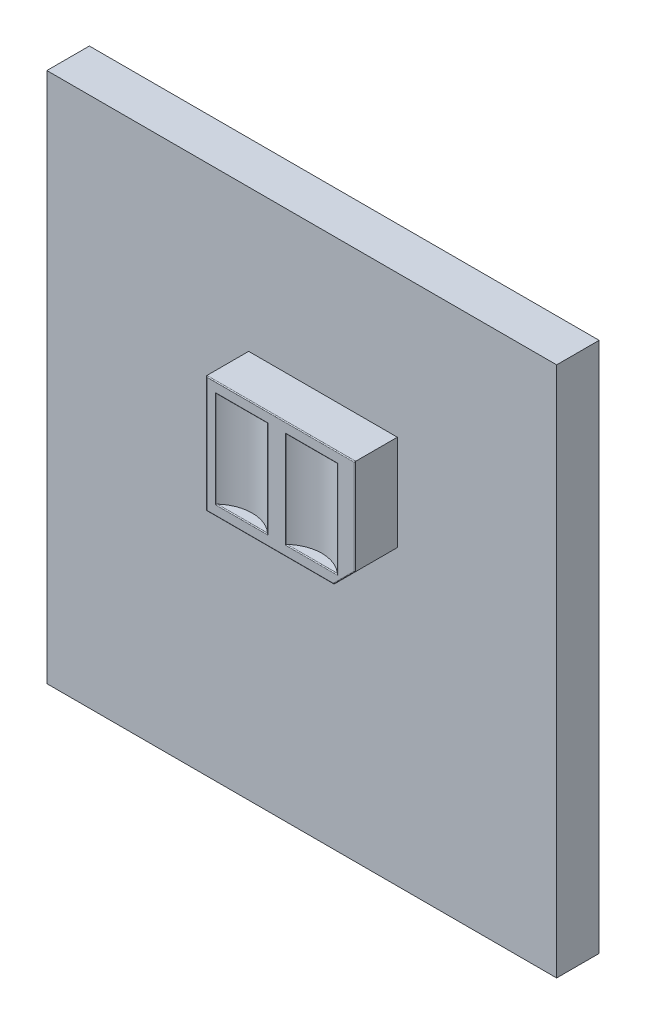
from build123d import *

# Parameters (mm, degrees)
ESQUISSE1_W             = 12
ESQUISSE1_H             = 12.5
EXTRUSION1_DEPTH        = 1
EXTRUSION2_DEPTH        = 2
ENL_V_MAT_EXTRU_1_DEPTH = 2.25
CONG_1_R                = 0.02


with BuildPart() as part:
    # Esquisse1 → Extrusion1 (new body)
    with BuildSketch(Plane.XY):
        Rectangle(ESQUISSE1_W, ESQUISSE1_H)
    extrude(amount=EXTRUSION1_DEPTH)

    # Esquisse3 → Extrusion2 (add)
    with BuildSketch(Plane.XY):
        Polygon((-1.25, 2.9), (2.25, 2.9), (2.25, 0.65), (1.75, 0.15), (-1.25, 0.15), align=None)
    extrude(amount=EXTRUSION2_DEPTH)

    # Esquisse4 → Enlèv. mat.-Extru.1 (cut)
    with BuildSketch(Plane.XZ.offset(-0.4)):
        with BuildLine():
            Line((0.619431951, 2), (1.839642881, 2))
            ThreePointArc((1.839642881, 2), (1.229537416, 1.755105285), (0.619431951, 2))
        make_face()
        with BuildLine():
            Line((0.197380528, 2), (-1.022830402, 2))
            ThreePointArc((-1.022830402, 2), (-0.412724937, 1.755105285), (0.197380528, 2))
        make_face()
    extrude(amount=-ENL_V_MAT_EXTRU_1_DEPTH, mode=Mode.SUBTRACT)

    # Congé1
    cong_1_edges = [part.edges().sort_by_distance(p)[0] for p in [
        (0.5, 2.9, 2),
        (2.25, 1.775, 2),
        (2, 0.4, 2),
        (0.25, 0.15, 2),
        (-1.25, 1.525, 2),
        (1.229537416, 0.4, 2),
        (0.619431951, 1.525, 2),
        (1.229537416, 2.65, 2),
        (1.839642881, 1.525, 2),
        (-0.412724937, 0.4, 2),
        (-1.022830402, 1.525, 2),
        (-0.412724937, 2.65, 2),
        (0.197380528, 1.525, 2),
    ]]
    fillet(cong_1_edges, radius=CONG_1_R)


solid = part.part
